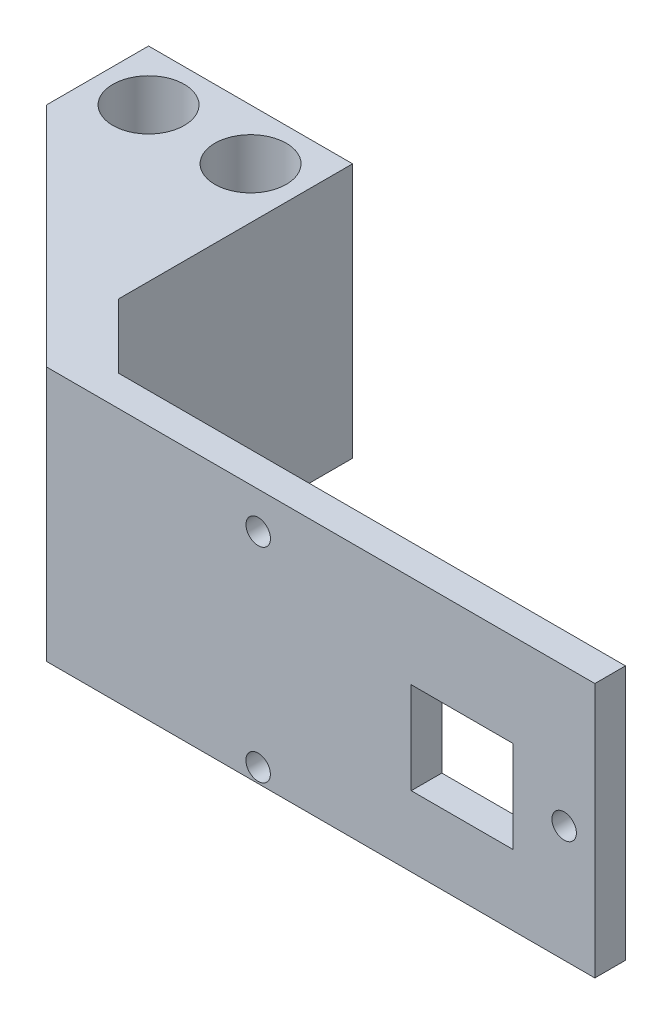
from build123d import *

# Parameters (mm, degrees)
BOSS_EXTRUDE1_DEPTH                          = 25
SKETCH2_W                                    = 10
SKETCH2_H                                    = 9
CUT_EXTRUDE1_DEPTH                           = 87.261593424
CBORE_FOR_M3_PAN_HEAD_SCREW1_D               = 3.4
CBORE_FOR_M3_PAN_HEAD_SCREW1_CBORE_D         = 7
CBORE_FOR_M3_PAN_HEAD_SCREW1_CBORE_DEPTH     = 5
CBORE_FOR_M2_HEX_SOCKET_HEAD_CAP_SCR_2_COUNT = 2
CBORE_FOR_M2_HEX_SOCKET_HEAD_CAP_SCR_2_PITCH = 20.008001599
CBORE_FOR_M2_HEX_SOCKET_HEAD_CAP_SCR_3_COUNT = 2
CBORE_FOR_M2_HEX_SOCKET_HEAD_CAP_SCR_3_PITCH = 31.613289927


with BuildPart() as part:
    # Sketch1 → Boss-Extrude1 (new body)
    with BuildSketch(Plane(origin=(0, 0, 0), x_dir=(1, 0, 0), z_dir=(0, 1, 0))):
        Polygon((0, 0), (0, -3), (-53.75, -3), (-76, 19.25), (-76, 29.25), (-56, 29.25), (-56, 6.321067812), (-49.678932188, 0), align=None)
    extrude(amount=BOSS_EXTRUDE1_DEPTH)

    # Sketch2 → Cut-Extrude1 (cut, through all)
    with BuildSketch(Plane.XY.offset(3)):
        with Locations((-13, 11.4)):
            Rectangle(SKETCH2_W, SKETCH2_H)
    extrude(amount=-CUT_EXTRUDE1_DEPTH, mode=Mode.SUBTRACT)

    # CBORE for M3 Pan Head Screw1 (through all)
    with Locations(Plane(origin=(0, 25, 0), x_dir=(1, 0, 0), z_dir=(0, 1, 0))):
        with Locations((-71, 24.25), (-61, 24.25)):
            CounterBoreHole(CBORE_FOR_M3_PAN_HEAD_SCREW1_D / 2, CBORE_FOR_M3_PAN_HEAD_SCREW1_CBORE_D / 2, CBORE_FOR_M3_PAN_HEAD_SCREW1_CBORE_DEPTH)

    # Sketch6 → CBORE for M2 Hex Socket Head Cap Screw1 (revolve, cut)
    with BuildSketch(Plane(origin=(-33, 21.4, 0), x_dir=(0, 1, 0), z_dir=(1, 0, 0))):
        Polygon((0, 0), (0, 3), (1.2, 3), (1.2, 1), (2.2, 1), (2.2, 0.025), (2.225, 0), align=None)
    cbore_for_m2_hex_socket_head_cap_screw1 = revolve(axis=Axis((-33, 21.4, -6.35), (0, 0, 1)), mode=Mode.SUBTRACT)

    # CBORE for M2 Hex Socket Head Cap Scr 2: CBORE for M2 Hex Socket Head Cap Screw1 ×2
    with Locations(*[Vector(-0.0003998400320129169, -0.9999999200639712, 0) * (i * CBORE_FOR_M2_HEX_SOCKET_HEAD_CAP_SCR_2_PITCH) for i in range(1, CBORE_FOR_M2_HEX_SOCKET_HEAD_CAP_SCR_2_COUNT)]):
        add(cbore_for_m2_hex_socket_head_cap_screw1, mode=Mode.SUBTRACT)

    # CBORE for M2 Hex Socket Head Cap Scr 3: CBORE for M2 Hex Socket Head Cap Screw1 ×2
    with Locations(*[Vector(0.9486516610381267, -0.31632266123312, 0) * (i * CBORE_FOR_M2_HEX_SOCKET_HEAD_CAP_SCR_3_PITCH) for i in range(1, CBORE_FOR_M2_HEX_SOCKET_HEAD_CAP_SCR_3_COUNT)]):
        add(cbore_for_m2_hex_socket_head_cap_screw1, mode=Mode.SUBTRACT)


solid = part.part
